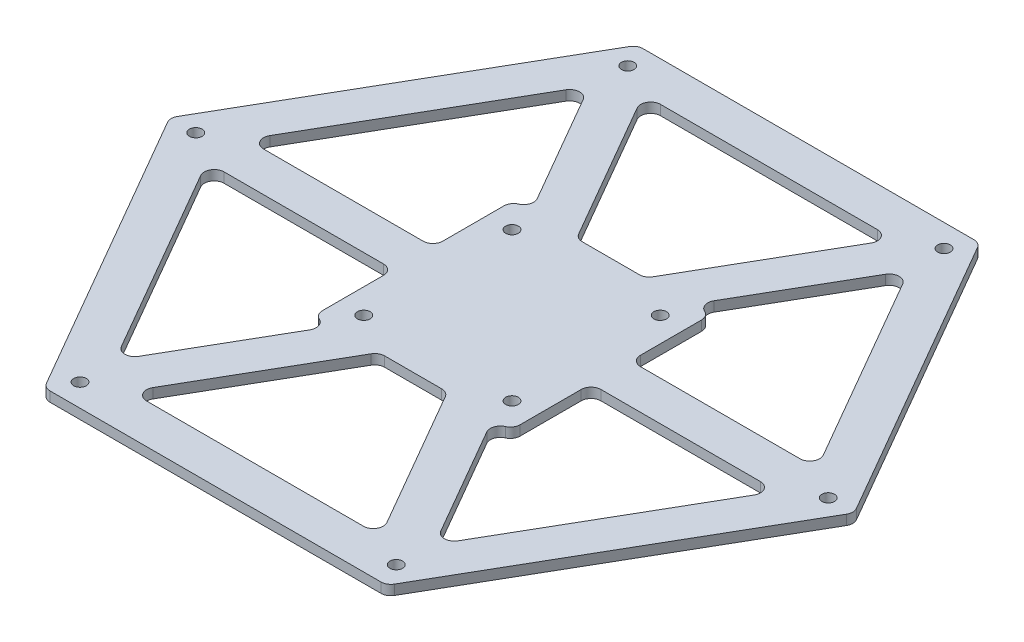
from build123d import *

# Parameters (mm, degrees)
SKETCH1_R           = 3.2
BOSS_EXTRUDE1_DEPTH = 10
SKETCH2_W           = 100
SKETCH2_H           = 100
BOSS_EXTRUDE2_DEPTH = 10
FILLET1_R           = 5
FILLET2_R           = 5
SKETCH3_R           = 3.2
CUT_EXTRUDE2_DEPTH  = 10
CUT_EXTRUDE3_START  = -5
CUT_EXTRUDE3_DEPTH  = 5


with BuildPart() as part:
    # Sketch1 → Boss-Extrude1 (new body)
    with BuildSketch(Plane(origin=(0, 0, 0), x_dir=(1, 0, 0), z_dir=(0, 1, 0))):
        with BuildLine():
            ThreePointArc((171.761705084, -2.5), (172.431578065, 0), (171.761705084, 2.5))
            Line((171.761705084, 2.5), (88.045916051, 147.5))
            ThreePointArc((88.045916051, 147.5), (86.215789032, 149.330127019), (83.715789032, 150))
            Line((83.715789032, 150), (-83.715789032, 150))
            ThreePointArc((-83.715789032, 150), (-86.215789032, 149.330127019), (-88.045916051, 147.5))
            Line((-88.045916051, 147.5), (-171.761705084, 2.5))
            ThreePointArc((-171.761705084, 2.5), (-172.431578065, 0), (-171.761705084, -2.5))
            Line((-171.761705084, -2.5), (-88.045916051, -147.5))
            ThreePointArc((-88.045916051, -147.5), (-86.215789032, -149.330127019), (-83.715789032, -150))
            Line((-83.715789032, -150), (83.715789032, -150))
            ThreePointArc((83.715789032, -150), (86.215789032, -149.330127019), (88.045916051, -147.5))
            Line((88.045916051, -147.5), (171.761705084, -2.5))
        make_face()
        with Locations((-80, -138.564064606)):
            Circle(SKETCH1_R, mode=Mode.SUBTRACT)
        with Locations((80, -138.564064606)):
            Circle(SKETCH1_R, mode=Mode.SUBTRACT)
        with Locations((-160, 0)):
            Circle(SKETCH1_R, mode=Mode.SUBTRACT)
        with Locations((-80, 138.564064606)):
            Circle(SKETCH1_R, mode=Mode.SUBTRACT)
        with BuildLine():
            ThreePointArc((-85.159164705, 112.5), (-80.829037687, 115), (-76.498910668, 112.5))
            Line((-76.498910668, 112.5), (-40.414518843, 50))
            Line((-40.414518843, 50), (-17.320508076, 50))
            Line((-17.320508076, 50), (-59.178402592, 122.5))
            ThreePointArc((-59.178402592, 122.5), (-59.178402592, 127.5), (-54.848275573, 130))
            Line((-54.848275573, 130), (54.848275573, 130))
            ThreePointArc((54.848275573, 130), (59.178402592, 127.5), (59.178402592, 122.5))
            Line((59.178402592, 122.5), (17.320508076, 50))
            Line((17.320508076, 50), (40.414518843, 50))
            Line((40.414518843, 50), (76.498910668, 112.5))
            ThreePointArc((76.498910668, 112.5), (80.829037687, 115), (85.159164705, 112.5))
            Line((85.159164705, 112.5), (140.007440278, 17.5))
            ThreePointArc((140.007440278, 17.5), (140.007440278, 12.5), (135.67731326, 10))
            Line((135.67731326, 10), (50, 10))
            Line((50, 10), (50, -10))
            Line((50, -10), (135.67731326, -10))
            ThreePointArc((135.67731326, -10), (140.007440278, -12.5), (140.007440278, -17.5))
            Line((140.007440278, -17.5), (85.159164705, -112.5))
            ThreePointArc((85.159164705, -112.5), (80.829037687, -115), (76.498910668, -112.5))
            Line((76.498910668, -112.5), (40.414518843, -50))
            Line((40.414518843, -50), (17.320508076, -50))
            Line((17.320508076, -50), (59.178402592, -122.5))
            ThreePointArc((59.178402592, -122.5), (59.178402592, -127.5), (54.848275573, -130))
            Line((54.848275573, -130), (-54.848275573, -130))
            ThreePointArc((-54.848275573, -130), (-59.178402592, -127.5), (-59.178402592, -122.5))
            Line((-59.178402592, -122.5), (-17.320508076, -50))
            Line((-17.320508076, -50), (-40.414518843, -50))
            Line((-40.414518843, -50), (-76.498910668, -112.5))
            ThreePointArc((-76.498910668, -112.5), (-80.829037687, -115), (-85.159164705, -112.5))
            Line((-85.159164705, -112.5), (-140.007440278, -17.5))
            ThreePointArc((-140.007440278, -17.5), (-140.007440278, -12.5), (-135.67731326, -10))
            Line((-135.67731326, -10), (-50, -10))
            Line((-50, -10), (-50, 10))
            Line((-50, 10), (-135.67731326, 10))
            ThreePointArc((-135.67731326, 10), (-140.007440278, 12.5), (-140.007440278, 17.5))
            Line((-140.007440278, 17.5), (-85.159164705, 112.5))
        make_face(mode=Mode.SUBTRACT)
        with Locations((160, 0)):
            Circle(SKETCH1_R, mode=Mode.SUBTRACT)
        with Locations((80, 138.564064606)):
            Circle(SKETCH1_R, mode=Mode.SUBTRACT)
    extrude(amount=BOSS_EXTRUDE1_DEPTH)

    # Sketch2 → Boss-Extrude2 (add)
    with BuildSketch(Plane(origin=(0, 0, 0), x_dir=(1, 0, 0), z_dir=(0, 1, 0))):
        Rectangle(SKETCH2_W, SKETCH2_H)
    extrude(amount=BOSS_EXTRUDE2_DEPTH)

    # Fillet1
    fillet1_edges = [part.edges().sort_by_distance(p)[0] for p in [
        (-17.320508076, 5, -50),
        (17.320508076, 5, -50),
        (40.414518843, 5, -50),
        (50, 5, -10),
        (50, 5, 10),
        (40.414518843, 5, 50),
        (-17.320508076, 5, 50),
        (17.320508076, 5, 50),
        (-40.414518843, 5, -50),
        (-50, 5, -10),
        (-50, 5, 10),
        (-40.414518843, 5, 50),
    ]]
    fillet(fillet1_edges, radius=FILLET1_R)

    # Fillet2
    fillet2_edges = [part.edges().sort_by_distance(p)[0] for p in [
        (-50, 5, -50),
        (-50, 5, 50),
        (50, 5, 50),
        (50, 5, -50),
    ]]
    fillet(fillet2_edges, radius=FILLET2_R)

    # Sketch3 → Cut-Extrude2 (cut)
    with BuildSketch(Plane(origin=(0, 10, 0), x_dir=(1, 0, 0), z_dir=(0, 1, 0))):
        with Locations((-37.5, 37.5)):
            Circle(SKETCH3_R)
        with Locations((37.5, 37.5)):
            Circle(SKETCH3_R)
        with Locations((37.5, -37.5)):
            Circle(SKETCH3_R)
        with Locations((-37.5, -37.5)):
            Circle(SKETCH3_R)
    extrude(amount=-CUT_EXTRUDE2_DEPTH, mode=Mode.SUBTRACT)

    # Sketch6 → Cut-Extrude3 (cut)
    with BuildSketch(Plane(origin=(0, 10, 0), x_dir=(1, 0, 0), z_dir=(0, 1, 0)).offset(CUT_EXTRUDE3_START)):
        with BuildLine():
            Line((88.045916051, 147.5), (171.761705084, 2.5))
            ThreePointArc((171.761705084, 2.5), (172.431578065, 0), (171.761705084, -2.5))
            Line((171.761705084, -2.5), (88.045916051, -147.5))
            ThreePointArc((88.045916051, -147.5), (86.215789032, -149.330127019), (83.715789032, -150))
            Line((83.715789032, -150), (-83.715789032, -150))
            ThreePointArc((-83.715789032, -150), (-86.215789032, -149.330127019), (-88.045916051, -147.5))
            Line((-88.045916051, -147.5), (-171.761705084, -2.5))
            ThreePointArc((-171.761705084, -2.5), (-172.431578065, 0), (-171.761705084, 2.5))
            Line((-171.761705084, 2.5), (-88.045916051, 147.5))
            ThreePointArc((-88.045916051, 147.5), (-86.215789032, 149.330127019), (-83.715789032, 150))
            Line((-83.715789032, 150), (83.715789032, 150))
            ThreePointArc((83.715789032, 150), (86.215789032, 149.330127019), (88.045916051, 147.5))
        make_face()
    extrude(amount=CUT_EXTRUDE3_DEPTH, mode=Mode.SUBTRACT)


solid = part.part
